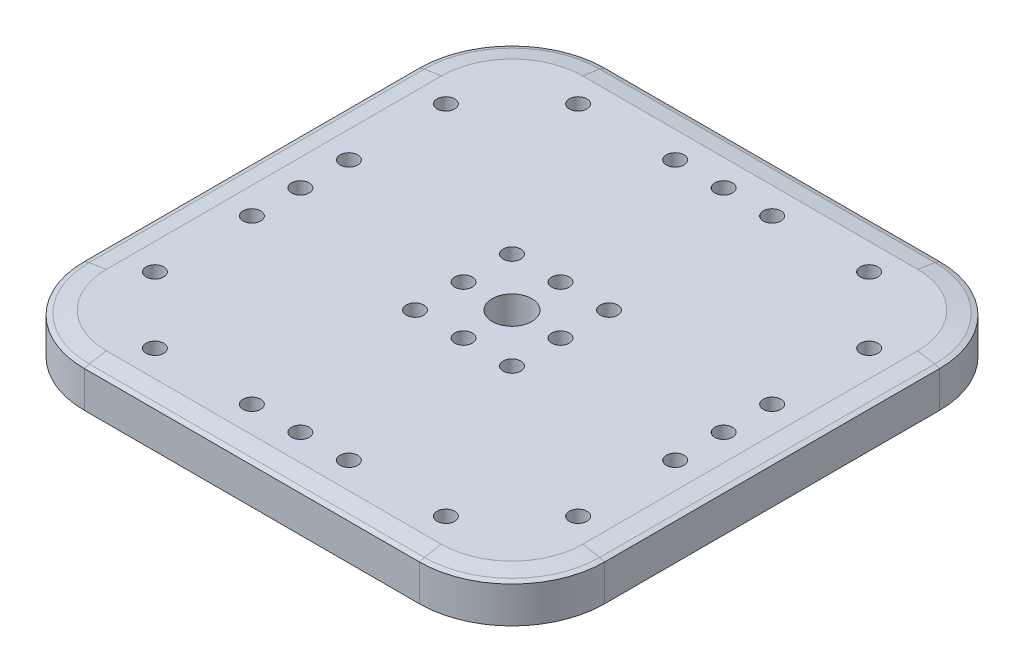
from build123d import *

# Parameters (mm, degrees)
SKETCH1_W           = 118
SKETCH1_H           = 118
SKETCH1_R           = 4.5
BOSS_EXTRUDE1_DEPTH = 9.85
SKETCH2_R           = 2
CUT_EXTRUDE1_DEPTH  = 5
FILLET1_R           = 21
CHAMFER1_SIZE       = 2
CHAMFER1_SIZE2      = 0.649839392
CHAMFER2_SIZE       = 3
CHAMFER2_SIZE2      = 0.974759089
CHAMFER3_SIZE       = 2


with BuildPart() as part:
    # Sketch1 → Boss-Extrude1 (new body)
    with BuildSketch(Plane(origin=(0, 0, 0), x_dir=(1, 0, 0), z_dir=(0, 1, 0))):
        Rectangle(SKETCH1_W, SKETCH1_H)
        with Locations(Location((0, 0, 0), (0, 0, 270))):
            Circle(SKETCH1_R, mode=Mode.SUBTRACT)
    extrude(amount=BOSS_EXTRUDE1_DEPTH)

    # Sketch2 → Cut-Extrude1 (cut)
    with BuildSketch(Plane(origin=(0, 9.85, 0), x_dir=(1, 0, 0), z_dir=(0, 1, 0))):
        with Locations(Location((0, -48, 0), (0, 0, 270))):
            Circle(SKETCH2_R)
        with Locations(Location((11, -48, 0), (0, 0, 270))):
            Circle(SKETCH2_R)
        with Locations(Location((33, -48, 0), (0, 0, 270))):
            Circle(SKETCH2_R)
        with Locations(Location((-33, -48, 0), (0, 0, 90))):
            Circle(SKETCH2_R)
        with Locations(Location((-11, -48, 0), (0, 0, 90))):
            Circle(SKETCH2_R)
        with Locations(Location((0, -11, 0), (0, 0, 270))):
            Circle(SKETCH2_R)
        with Locations(Location((11, -11, 0), (0, 0, 270))):
            Circle(SKETCH2_R)
        with Locations(Location((-11, -11, 0), (0, 0, 90))):
            Circle(SKETCH2_R)
        with Locations(Location((-11, 0, 0), (0, 0, 270))):
            Circle(SKETCH2_R)
        with Locations(Location((-11, 11, 0), (0, 0, 270))):
            Circle(SKETCH2_R)
        with Locations(Location((11, 11, 0), (0, 0, 90))):
            Circle(SKETCH2_R)
        with Locations(Location((0, 11, 0), (0, 0, 90))):
            Circle(SKETCH2_R)
        with Locations(Location((-11, 48, 0), (0, 0, 270))):
            Circle(SKETCH2_R)
        with Locations(Location((-33, 48, 0), (0, 0, 270))):
            Circle(SKETCH2_R)
        with Locations(Location((33, 48, 0), (0, 0, 90))):
            Circle(SKETCH2_R)
        with Locations(Location((11, 48, 0), (0, 0, 90))):
            Circle(SKETCH2_R)
        with Locations(Location((0, 48, 0), (0, 0, 90))):
            Circle(SKETCH2_R)
        with Locations(Location((11, 0, 0), (0, 0, 90))):
            Circle(SKETCH2_R)
        with Locations(Location((48, 11, 0), (0, 0, 270))):
            Circle(SKETCH2_R)
        with Locations(Location((48, 33, 0), (0, 0, 270))):
            Circle(SKETCH2_R)
        with Locations(Location((48, -33, 0), (0, 0, 90))):
            Circle(SKETCH2_R)
        with Locations(Location((48, -11, 0), (0, 0, 90))):
            Circle(SKETCH2_R)
        with Locations(Location((48, 0, 0), (0, 0, 90))):
            Circle(SKETCH2_R)
        with Locations(Location((-48, 0, 0), (0, 0, 270))):
            Circle(SKETCH2_R)
        with Locations(Location((-48, -11, 0), (0, 0, 270))):
            Circle(SKETCH2_R)
        with Locations(Location((-48, -33, 0), (0, 0, 270))):
            Circle(SKETCH2_R)
        with Locations(Location((-48, 33, 0), (0, 0, 90))):
            Circle(SKETCH2_R)
        with Locations(Location((-48, 11, 0), (0, 0, 90))):
            Circle(SKETCH2_R)
    extrude(amount=-CUT_EXTRUDE1_DEPTH, mode=Mode.SUBTRACT)

    # Fillet1
    fillet1_edges = [part.edges().sort_by_distance(p)[0] for p in [
        (59, 4.925, 59),
        (-59, 4.925, 59),
        (-59, 4.925, -59),
        (59, 4.925, -59),
    ]]
    fillet(fillet1_edges, radius=FILLET1_R)

    # Chamfer1
    chamfer1_edges = [part.edges().sort_by_distance(p)[0] for p in [
        (0, 0, -59),
        (59, 0, 0),
        (0, 0, 59),
        (-59, 0, 0),
        (52.849242405, 0, 52.849242405),
        (-52.849242405, 0, 52.849242405),
        (-52.849242405, 0, -52.849242405),
        (52.849242405, 0, -52.849242405),
    ]]
    chamfer1_side = [part.faces().sort_by_distance(p)[0] for p in [
        (0, 0, 57.331227996),
    ]]
    chamfer(chamfer1_edges, length=CHAMFER1_SIZE, length2=CHAMFER1_SIZE2, reference=chamfer1_side[0])

    # Chamfer2
    chamfer2_edges = [part.edges().sort_by_distance(p)[0] for p in [
        (0, 9.85, -59),
        (59, 9.85, 0),
        (-59, 9.85, 0),
        (0, 9.85, 59),
        (52.849242405, 9.85, 52.849242405),
        (-52.849242405, 9.85, 52.849242405),
        (-52.849242405, 9.85, -52.849242405),
        (52.849242405, 9.85, -52.849242405),
    ]]
    chamfer2_side = [part.faces().sort_by_distance(p)[0] for p in [
        (0, 9.85, 57.331227996),
    ]]
    chamfer(chamfer2_edges, length=CHAMFER2_SIZE, length2=CHAMFER2_SIZE2, reference=chamfer2_side[0])

    # Chamfer3
    chamfer3_edges = [part.edges().sort_by_distance(p)[0] for p in [
        (-50.727922061, 9.85, 50.727922061),
        (0, 9.85, 56),
        (-56, 9.85, 0),
        (50.727922061, 9.85, 50.727922061),
        (-50.727922061, 9.85, -50.727922061),
        (56, 9.85, 0),
        (0, 9.85, -56),
        (50.727922061, 9.85, -50.727922061),
    ]]
    chamfer(chamfer3_edges, length=CHAMFER3_SIZE)


solid = part.part
